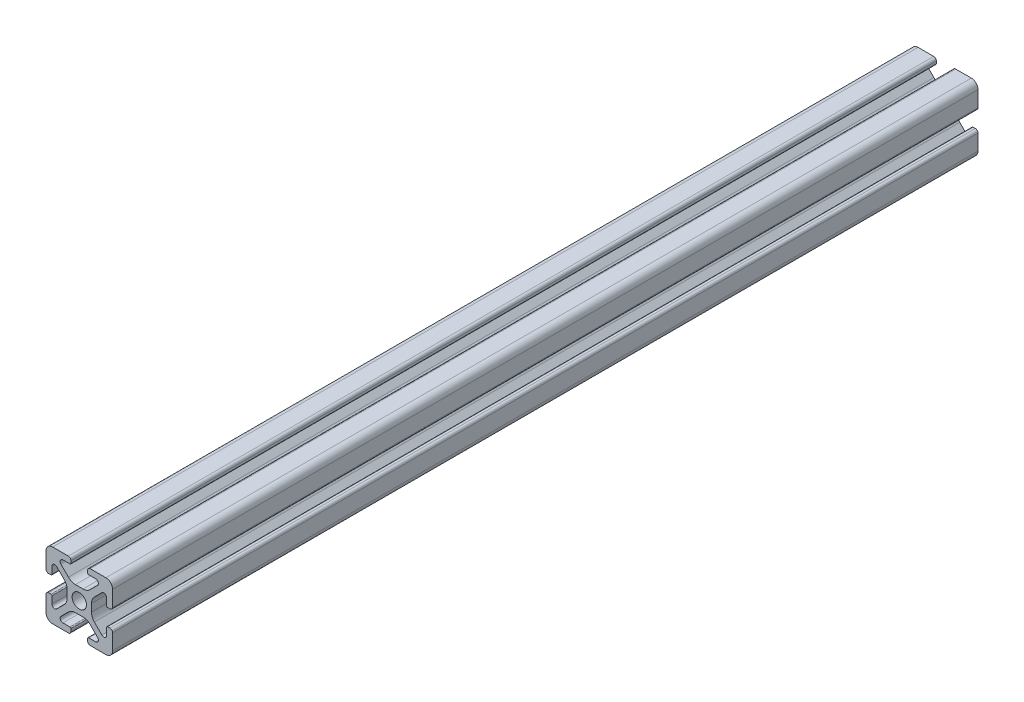
from build123d import *

# Parameters (mm, degrees)
BOSS_EXTRU_1_DEPTH = 260


with BuildPart() as part:
    # Esquisse1 → Boss.-Extru.1 (new body)
    with BuildSketch(Plane.XY):
        with BuildLine():
            Line((-3.255887446, 4.528679645), (-5.506192286, 6.778984485))
            ThreePointArc((-5.506192286, 6.778984485), (-5.686636441, 7.686138511), (-4.917588391, 8.199999989))
            Line((-4.917588391, 8.199999989), (-2.799999991, 8.199999989))
            ThreePointArc((-2.799999991, 8.199999989), (-2.587867957, 8.287867955), (-2.499999991, 8.499999989))
            Line((-2.499999991, 8.499999989), (-2.499999991, 9.199999989))
            ThreePointArc((-2.499999991, 9.199999989), (-2.734314566, 9.765685414), (-3.299999991, 9.999999989))
            Line((-3.299999991, 9.999999989), (-7.999999991, 9.999999989))
            ThreePointArc((-7.999999991, 9.999999989), (-9.414213554, 9.414213552), (-9.999999991, 7.999999989))
            Line((-9.999999991, 7.999999989), (-9.999999991, 3.299999989))
            ThreePointArc((-9.999999991, 3.299999989), (-9.765685416, 2.734314564), (-9.199999991, 2.499999989))
            Line((-9.199999991, 2.499999989), (-8.499999991, 2.499999989))
            ThreePointArc((-8.499999991, 2.499999989), (-8.287867957, 2.587867955), (-8.199999991, 2.799999989))
            Line((-8.199999991, 2.799999989), (-8.199999991, 4.917588389))
            ThreePointArc((-8.199999991, 4.917588389), (-7.686138517, 5.686636433), (-6.778984497, 5.506192279))
            Line((-6.778984497, 5.506192279), (-4.528679657, 3.255887439))
            ThreePointArc((-4.528679657, 3.255887439), (-3.878361403, 2.282617393), (-3.650000001, 1.134567096))
            Line((-3.650000001, 1.134567096), (-3.650000001, -1.134567114))
            ThreePointArc((-3.650000001, -1.134567114), (-3.878361403, -2.282617409), (-4.528679656, -3.255887454))
            Line((-4.528679656, -3.255887454), (-6.778984496, -5.506192294))
            ThreePointArc((-6.778984496, -5.506192294), (-7.686138522, -5.686636449), (-8.2, -4.9175884))
            Line((-8.2, -4.9175884), (-8.2, -2.8))
            ThreePointArc((-8.2, -2.8), (-8.287867966, -2.587867966), (-8.5, -2.5))
            Line((-8.5, -2.5), (-9.2, -2.5))
            ThreePointArc((-9.2, -2.5), (-9.765685425, -2.734314575), (-10, -3.3))
            Line((-10, -3.3), (-10, -8))
            ThreePointArc((-10, -8), (-9.414213562, -9.414213562), (-8, -10))
            Line((-8, -10), (-3.3, -10))
            ThreePointArc((-3.3, -10), (-2.734314575, -9.765685425), (-2.5, -9.2))
            Line((-2.5, -9.2), (-2.5, -8.5))
            ThreePointArc((-2.5, -8.5), (-2.587867966, -8.287867966), (-2.8, -8.2))
            Line((-2.8, -8.2), (-4.9175884, -8.2))
            ThreePointArc((-4.9175884, -8.2), (-5.686636444, -7.686138526), (-5.50619229, -6.778984506))
            Line((-5.50619229, -6.778984506), (-3.25588745, -4.528679666))
            ThreePointArc((-3.25588745, -4.528679666), (-2.282617404, -3.878361412), (-1.134567106, -3.650000009))
            Line((-1.134567106, -3.650000009), (1.134567104, -3.650000009))
            ThreePointArc((1.134567104, -3.650000009), (2.282617399, -3.878361412), (3.255887444, -4.528679664))
            Line((3.255887444, -4.528679664), (5.506192284, -6.778984504))
            ThreePointArc((5.506192284, -6.778984504), (5.686636439, -7.686138531), (4.917588389, -8.200000009))
            Line((4.917588389, -8.200000009), (2.799999989, -8.200000009))
            ThreePointArc((2.799999989, -8.200000009), (2.587867955, -8.287867974), (2.499999989, -8.500000009))
            Line((2.499999989, -8.500000009), (2.499999989, -9.200000009))
            ThreePointArc((2.499999989, -9.200000009), (2.734314564, -9.765685434), (3.299999989, -10.000000009))
            Line((3.299999989, -10.000000009), (7.999999989, -10.000000009))
            ThreePointArc((7.999999989, -10.000000009), (9.414213552, -9.414213571), (9.999999989, -8.000000009))
            Line((9.999999989, -8.000000009), (9.999999989, -3.300000009))
            ThreePointArc((9.999999989, -3.300000009), (9.765685414, -2.734314584), (9.199999989, -2.500000009))
            Line((9.199999989, -2.500000009), (8.499999989, -2.500000009))
            ThreePointArc((8.499999989, -2.500000009), (8.287867955, -2.587867974), (8.199999989, -2.800000009))
            Line((8.199999989, -2.800000009), (8.199999989, -4.917588409))
            ThreePointArc((8.199999989, -4.917588409), (7.686138515, -5.686636452), (6.778984495, -5.506192299))
            Line((6.778984495, -5.506192299), (4.528679655, -3.255887459))
            ThreePointArc((4.528679655, -3.255887459), (3.878361401, -2.282617412), (3.649999999, -1.134567115))
            Line((3.649999999, -1.134567115), (3.649999999, 1.134567095))
            ThreePointArc((3.649999999, 1.134567095), (3.878361401, 2.28261739), (4.528679654, 3.255887435))
            Line((4.528679654, 3.255887435), (6.778984494, 5.506192275))
            ThreePointArc((6.778984494, 5.506192275), (7.68613852, 5.68663643), (8.199999998, 4.917588381))
            Line((8.199999998, 4.917588381), (8.199999998, 2.799999981))
            ThreePointArc((8.199999998, 2.799999981), (8.287867964, 2.587867946), (8.499999998, 2.499999981))
            Line((8.499999998, 2.499999981), (9.199999998, 2.499999981))
            ThreePointArc((9.199999998, 2.499999981), (9.765685423, 2.734314556), (9.999999998, 3.299999981))
            Line((9.999999998, 3.299999981), (9.999999998, 7.999999981))
            ThreePointArc((9.999999998, 7.999999981), (9.41421356, 9.414213543), (7.999999998, 9.999999981))
            Line((7.999999998, 9.999999981), (3.299999998, 9.999999981))
            ThreePointArc((3.299999998, 9.999999981), (2.734314573, 9.765685406), (2.499999998, 9.199999981))
            Line((2.499999998, 9.199999981), (2.499999998, 8.499999981))
            ThreePointArc((2.499999998, 8.499999981), (2.587867964, 8.287867946), (2.799999998, 8.199999981))
            Line((2.799999998, 8.199999981), (4.917588398, 8.199999981))
            ThreePointArc((4.917588398, 8.199999981), (5.686636442, 7.686138507), (5.506192288, 6.778984487))
            Line((5.506192288, 6.778984487), (3.255887448, 4.528679647))
            ThreePointArc((3.255887448, 4.528679647), (2.282617402, 3.878361393), (1.134567104, 3.64999999))
            Line((1.134567104, 3.64999999), (-1.134567106, 3.64999999))
            ThreePointArc((-1.134567106, 3.64999999), (-2.282617401, 3.878361392), (-3.255887446, 4.528679645))
        make_face()
        with BuildLine():
            ThreePointArc((-2.15, 0), (0, -2.15), (2.15, 0))
            ThreePointArc((2.15, 0), (0, 2.15), (-2.15, 0))
        make_face(mode=Mode.SUBTRACT)
    extrude(amount=BOSS_EXTRU_1_DEPTH)


solid = part.part
